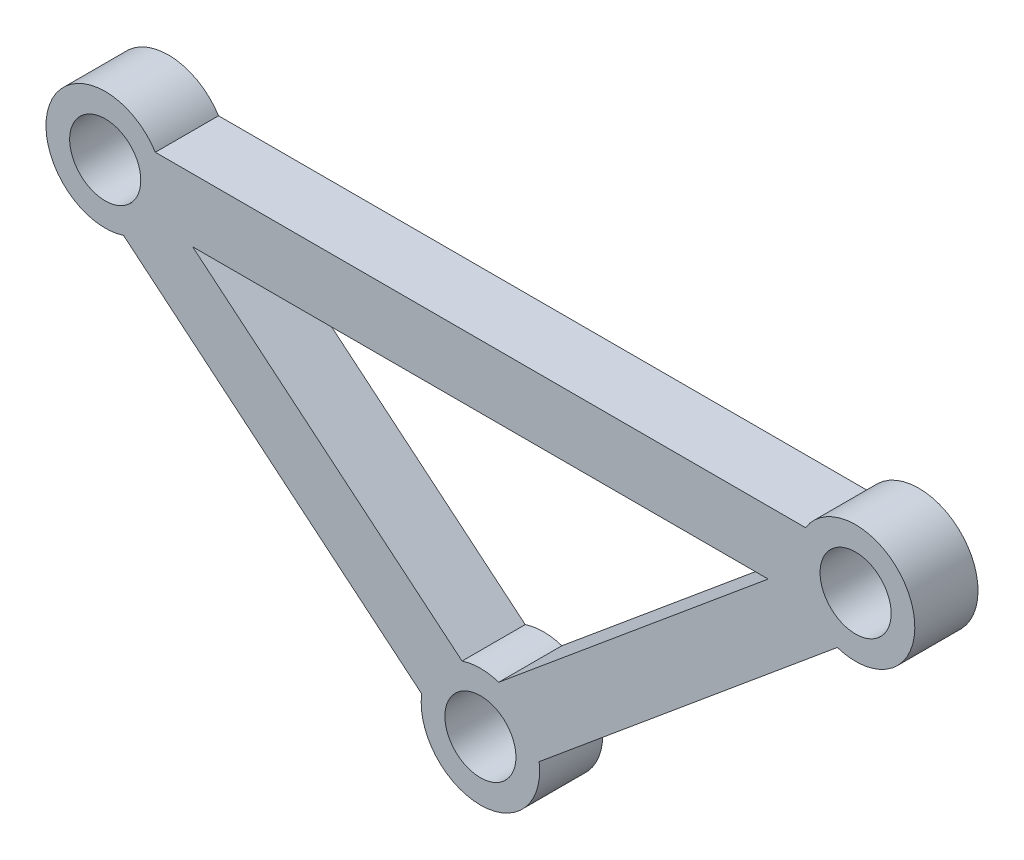
from build123d import *

# Parameters (mm, degrees)
SKETCH1_R           = 4.5
BOSS_EXTRUDE1_DEPTH = 8


with BuildPart() as part:
    # Sketch1 → Boss-Extrude1 (new body)
    with BuildSketch(Plane.XY):
        with BuildLine():
            Line((45.179528047, 16.128442524), (7.43557573, -15.258633613))
            ThreePointArc((7.43557573, -15.258633613), (-0.001652224, -23.739558281), (-7.43514282, -15.255357644))
            Line((-7.43514282, -15.255357644), (-45.17916835, 16.128559565))
            ThreePointArc((-45.17916835, 16.128559565), (-54.553423072, 25.809798901), (-41.15571123, 27.260441537))
            Line((-41.15571123, 27.260441537), (41.15571123, 27.260441537))
            ThreePointArc((41.15571123, 27.260441537), (54.553358782, 25.809976769), (45.179528047, 16.128442524))
        make_face()
        with Locations((-47.5, 23.260441537)):
            Circle(SKETCH1_R, mode=Mode.SUBTRACT)
        with Locations((47.5, 23.260441537)):
            Circle(SKETCH1_R, mode=Mode.SUBTRACT)
        with Locations((0, -16.239558463)):
            Circle(SKETCH1_R, mode=Mode.SUBTRACT)
        with BuildLine():
            Line((36.433890862, 19.260441537), (2.320471953, -9.107559451))
            ThreePointArc((2.320471953, -9.107559451), (-0.001660699, -8.739558647), (-2.323630152, -9.108587778))
            Line((-2.323630152, -9.108587778), (-36.434768163, 19.260441537))
            Line((-36.434768163, 19.260441537), (36.433890862, 19.260441537))
        make_face(mode=Mode.SUBTRACT)
    extrude(amount=BOSS_EXTRUDE1_DEPTH)


solid = part.part
